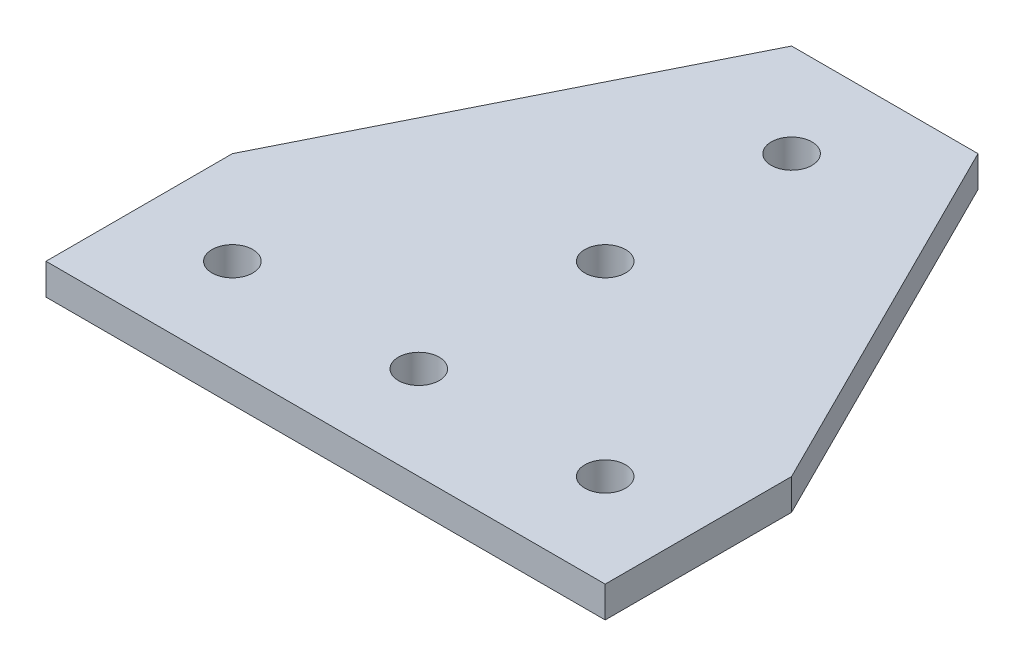
from build123d import *

# Parameters (mm, degrees)
SKETCH1_W           = 114.3
SKETCH1_H           = 6.35
BOSS_EXTRUDE1_DEPTH = 57.15
CUT_EXTRUDE1_DEPTH  = 82.071372876
SKETCH3_R           = 4.1656
CUT_EXTRUDE2_DEPTH  = 82.071372876
LPATTERN1_COUNT     = 3
LPATTERN1_PITCH     = 38.1
SKETCH4_R           = 4.1656
CUT_EXTRUDE3_DEPTH  = 82.071372876


with BuildPart() as part:
    # Sketch1 → Boss-Extrude1 (new, symmetric)
    with BuildSketch(Plane.XY):
        Rectangle(SKETCH1_W, SKETCH1_H)
    extrude(amount=BOSS_EXTRUDE1_DEPTH, both=True)

    # Sketch2 → Cut-Extrude1 (cut, through all)
    with BuildSketch(Plane(origin=(0, 3.175, 0), x_dir=(1, 0, 0), z_dir=(0, 1, 0))):
        Polygon((-57.15, -19.05), (-19.05, 57.15), (-57.15, 57.15), align=None)
        Polygon((57.15, -19.05), (19.05, 57.15), (57.15, 57.15), align=None)
    extrude(amount=-CUT_EXTRUDE1_DEPTH, mode=Mode.SUBTRACT)

    # Sketch3 → Cut-Extrude2 (cut, through all)
    with BuildSketch(Plane(origin=(0, 3.175, 0), x_dir=(1, 0, 0), z_dir=(0, 1, 0))):
        with Locations(Location((0, 38.1, 0), (0, 0, 270))):
            Circle(SKETCH3_R)
    cut_extrude2 = extrude(amount=-CUT_EXTRUDE2_DEPTH, mode=Mode.SUBTRACT)

    # LPattern1: Cut-Extrude2 ×3
    with Locations(*[(0, 0, i * LPATTERN1_PITCH) for i in range(1, LPATTERN1_COUNT)]):
        add(cut_extrude2, mode=Mode.SUBTRACT)

    # Sketch4 → Cut-Extrude3 (cut, through all)
    with BuildSketch(Plane(origin=(0, 3.175, 0), x_dir=(1, 0, 0), z_dir=(0, 1, 0))):
        with Locations(Location((-38.1, -38.1, 0), (0, 0, 270))):
            Circle(SKETCH4_R)
        with Locations(Location((38.1, -38.1, 0), (0, 0, 90))):
            Circle(SKETCH4_R)
    extrude(amount=-CUT_EXTRUDE3_DEPTH, mode=Mode.SUBTRACT)


solid = part.part
